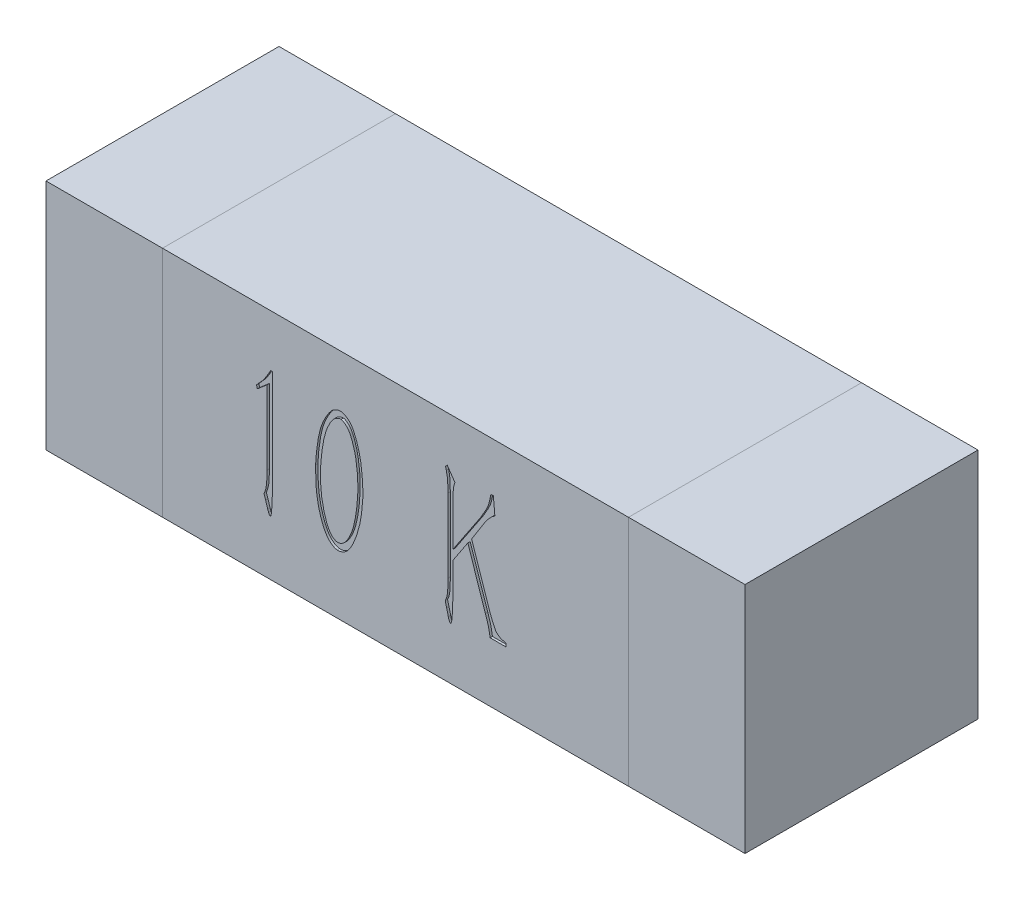
from build123d import *

# Parameters (mm, degrees)
SKETCH_1_W          = 2
SKETCH_1_H          = 1
EXTRUDE_1_DEPTH     = 1
SKETCH_2_W          = 0.5
SKETCH_2_H          = 1
EXTRUDE_2_DEPTH     = 1
EXTRUDE_2_2_DEPTH   = 1
CUT_EXTRUDE_1_DEPTH = 0.01


with BuildPart() as part:
    # 草图1 → 凸台-拉伸1 (new body)
    with BuildSketch(Plane.XY):
        Rectangle(SKETCH_1_W, SKETCH_1_H)
    extrude(amount=EXTRUDE_1_DEPTH)

    # 草图4 → 切除-拉伸1 (cut)
    # profile 1 of 3: a face of its own
    with BuildSketch(Plane.XY.offset(1)):
        with BuildLine():
            Line((-0.536267597, 0.277199445), (-0.527367343, 0.277199445))
            Line((-0.527367343, 0.277199445), (-0.528209259, -0.153981747))
            add(Edge.make_bspline(
                [(-0.528209259, -0.153981747), (-0.528305169, -0.157870332), (-0.528489066, -0.165326261), (-0.528503991, -0.175993761), (-0.528854819, -0.185652194), (-0.528882762, -0.194315386), (-0.529143633, -0.201972021), (-0.529445304, -0.2086237), (-0.529473969, -0.214282893), (-0.530007571, -0.223140259), (-0.53064343, -0.235318477), (-0.532220325, -0.247861835), (-0.533475653, -0.256799503), (-0.534751797, -0.260868085), (-0.536368541, -0.264087281), (-0.537982047, -0.263711863), (-0.538673071, -0.263551082)],
                knots=[0, 0, 0, 0, 1.45038606, 2.780953852, 3.977268029, 5.053718292, 6.010937745, 6.833690271, 7.536464333, 8.120251454, 10.142880859, 12.069479857, 12.873132744, 13.440417135, 13.76034519, 14, 14, 14, 14], degree=3))
            add(Edge.make_bspline(
                [(-0.538673071, -0.263551082), (-0.538832813, -0.263430167), (-0.53951655, -0.262912626), (-0.541147073, -0.26181718), (-0.543084471, -0.258880772), (-0.543932542, -0.25624642), (-0.544446208, -0.254650828)],
                knots=[0, 0, 0, 0, 0.221265066, 0.947068446, 2.150880552, 4, 4, 4, 4], degree=3))
            Line((-0.544446208, -0.254650828), (-0.54841524, -0.244066743))
            Line((-0.54841524, -0.244066743), (-0.557435767, -0.214840236))
            add(Edge.make_bspline(
                [(-0.557435767, -0.214840236), (-0.558521644, -0.212090322), (-0.560413185, -0.207300116), (-0.562321333, -0.200997933), (-0.563768918, -0.196973723), (-0.564153675, -0.193711926), (-0.562300301, -0.190652352), (-0.560935355, -0.185941541), (-0.558835067, -0.1799285), (-0.556851676, -0.172831482), (-0.555099874, -0.165163267), (-0.553521806, -0.156878001), (-0.55262747, -0.147543262), (-0.552188763, -0.138630546), (-0.551852081, -0.130049469), (-0.551790911, -0.121788282), (-0.551622197, -0.112006784), (-0.551648553, -0.104950279), (-0.551662629, -0.101181595)],
                knots=[0, 0, 0, 0, 1.220359697, 2.125803599, 2.712350858, 2.994193817, 3.439826662, 4.12562012, 5.031064022, 6.063176816, 7.167225426, 8.277459231, 9.542238136, 11.034069985, 11.961482632, 13.08703073, 14.444263491, 16, 16, 16, 16], degree=3))
            Line((-0.551662629, -0.101181595), (-0.550940987, 0.217062598))
            Line((-0.550940987, 0.217062598), (-0.593157054, 0.180499395))
            Line((-0.593157054, 0.180499395), (-0.596404443, 0.19433087))
            add(Edge.make_bspline(
                [(-0.596404443, 0.19433087), (-0.592972873, 0.197876729), (-0.586540253, 0.204523589), (-0.577943421, 0.214093872), (-0.570872827, 0.222399361), (-0.563508332, 0.232108868), (-0.555262939, 0.244192288), (-0.549173977, 0.254119734), (-0.546009766, 0.259278665)],
                knots=[0, 0, 0, 0, 1.077185482, 2.019228619, 2.808185376, 3.45765616, 4.678836699, 6, 6, 6, 6], degree=3))
            Line((-0.546009766, 0.259278665), (-0.536267597, 0.277199445))
        make_face()
    # profile 2 of 3: a face of its own
    with BuildSketch(Plane.XY.offset(1)):
        with BuildLine():
            add(Edge.make_bspline(
                [(-0.342867497, 0.023903046), (-0.342475548, 0.03168383), (-0.341672519, 0.047625199), (-0.339489492, 0.072059552), (-0.336269456, 0.097550249), (-0.332535443, 0.123728694), (-0.327368574, 0.149589337), (-0.32075595, 0.174182594), (-0.312314406, 0.196921185), (-0.303891067, 0.21438151), (-0.296770358, 0.227183204), (-0.291589363, 0.235699199), (-0.286660367, 0.243379176), (-0.281804175, 0.250051654), (-0.277037807, 0.255733425), (-0.272642007, 0.260660002), (-0.268205668, 0.264495579), (-0.262641857, 0.268298905), (-0.255869501, 0.271691069), (-0.248021606, 0.274658595), (-0.240470215, 0.276375215), (-0.235550857, 0.276363284), (-0.233177889, 0.276357529)],
                knots=[0, 0, 0, 0, 1.583211401, 3.243703523, 4.983978234, 6.804605119, 8.6166428, 10.340282122, 11.974804003, 13.53820457, 14.274983449, 14.951299633, 15.563740824, 16.129235462, 16.626851747, 17.070813204, 17.469389546, 17.815167281, 18.438300608, 19.002855301, 19.519003895, 20, 20, 20, 20], degree=3))
            add(Edge.make_bspline(
                [(-0.233177889, 0.276357529), (-0.230908792, 0.275960752), (-0.226116106, 0.275122696), (-0.219030562, 0.27200664), (-0.211510276, 0.267862635), (-0.203509087, 0.262491637), (-0.19552066, 0.25527004), (-0.188117295, 0.245705243), (-0.181244193, 0.234023929), (-0.172702923, 0.215536448), (-0.163290732, 0.190477924), (-0.155900326, 0.164166836), (-0.151099749, 0.1421983), (-0.147969005, 0.124670959), (-0.145479562, 0.106084984), (-0.142806295, 0.079956717), (-0.140422232, 0.046475877), (-0.140037994, 0.019497595), (-0.139845502, 0.005982266)],
                knots=[0, 0, 0, 0, 0.36369769, 0.768186139, 1.217229854, 1.724510149, 2.290946358, 2.914777825, 3.632489608, 4.433551378, 6.137860108, 7.866765886, 8.757390638, 9.699141408, 10.686159515, 11.726895222, 13.859299765, 16, 16, 16, 16], degree=3))
            add(Edge.make_bspline(
                [(-0.139845502, 0.005982266), (-0.140581787, -0.004847419), (-0.142095004, -0.02710468), (-0.145694863, -0.06119257), (-0.151632015, -0.096654519), (-0.159103169, -0.126526097), (-0.166329634, -0.150310263), (-0.172457926, -0.167472695), (-0.179314808, -0.183680155), (-0.186633233, -0.198775573), (-0.194246678, -0.212213258), (-0.202127744, -0.223504804), (-0.210455643, -0.232201566), (-0.219011466, -0.238448456), (-0.227365129, -0.242681881), (-0.235347013, -0.245388674), (-0.24294819, -0.246891146), (-0.247886763, -0.246608065), (-0.250256753, -0.246472217)],
                knots=[0, 0, 0, 0, 1.760488992, 3.618172134, 5.557361062, 7.587083219, 8.607294374, 9.588398617, 10.541277716, 11.460251193, 12.307925722, 13.044175775, 13.687957546, 14.251129358, 14.754223989, 15.200440537, 15.616296545, 16, 16, 16, 16], degree=3))
            add(Edge.make_bspline(
                [(-0.250256753, -0.246472217), (-0.252521344, -0.246153894), (-0.257292663, -0.245483211), (-0.264484714, -0.2426609), (-0.271974284, -0.238312478), (-0.279969914, -0.232580364), (-0.288021072, -0.224705299), (-0.295773863, -0.214519445), (-0.303208686, -0.201967456), (-0.310274229, -0.187288782), (-0.316910498, -0.170939239), (-0.322721388, -0.15329783), (-0.328105062, -0.134759644), (-0.332418835, -0.115376996), (-0.335968614, -0.095787708), (-0.338753836, -0.076532326), (-0.340708115, -0.057836114), (-0.341762788, -0.039773641), (-0.34213158, -0.022482982), (-0.342521341, -0.006126426), (-0.34276517, 0.009229013), (-0.342834228, 0.019132125), (-0.342867497, 0.023903046)],
                knots=[0, 0, 0, 0, 0.451175502, 0.950591959, 1.515271951, 2.162531354, 2.891688268, 3.734081857, 4.687580886, 5.773002708, 6.954198864, 8.17563603, 9.445923076, 10.771603705, 12.101713585, 13.383756751, 14.619631726, 15.819374781, 16.961914306, 18.040825747, 19.056148764, 20, 20, 20, 20], degree=3))
        make_face()
        with BuildLine():
            add(Edge.make_bspline(
                [(-0.321699327, 0.022219215), (-0.32178492, 0.018330544), (-0.321966679, 0.010072876), (-0.322139537, -0.003079176), (-0.321817058, -0.017713864), (-0.321266048, -0.039309597), (-0.319243077, -0.06753251), (-0.314072731, -0.10141542), (-0.306688487, -0.134228325), (-0.298551718, -0.159941073), (-0.290976448, -0.178270716), (-0.28516351, -0.189646753), (-0.279048089, -0.198837039), (-0.272640981, -0.205837355), (-0.266160031, -0.210798367), (-0.260103345, -0.214343401), (-0.25436388, -0.216777683), (-0.250517382, -0.217095151), (-0.248693195, -0.21724571)],
                knots=[0, 0, 0, 0, 0.705717407, 1.498604912, 2.386138873, 3.361274458, 5.418191474, 7.514713171, 9.57394393, 11.515405308, 12.398906158, 13.169972934, 13.829695216, 14.395845116, 14.883250105, 15.303691084, 15.669778158, 16, 16, 16, 16], degree=3))
            add(Edge.make_bspline(
                [(-0.248693195, -0.21724571), (-0.247004407, -0.217223989), (-0.243376914, -0.217177332), (-0.237701531, -0.2158125), (-0.231735035, -0.212939484), (-0.225116851, -0.209164089), (-0.218317836, -0.203353655), (-0.211607087, -0.195413035), (-0.205029541, -0.185236213), (-0.198469669, -0.173202445), (-0.192264506, -0.159814176), (-0.186705986, -0.14562978), (-0.181868584, -0.130987522), (-0.176636893, -0.110502014), (-0.171258462, -0.0839331), (-0.166427402, -0.051488117), (-0.163223604, -0.019492727), (-0.161889391, 0.006609391), (-0.161518264, 0.027270715), (-0.161826693, 0.043712144), (-0.162408612, 0.061355531), (-0.163074916, 0.073537027), (-0.163419146, 0.079830314)],
                knots=[0, 0, 0, 0, 0.308126263, 0.661851094, 1.055455993, 1.515432549, 2.051181639, 2.679899785, 3.409545513, 4.262246801, 5.183512362, 6.104777924, 7.045624675, 8.000099589, 9.967578284, 11.997814557, 13.993544283, 15.842664909, 16.77344086, 17.770161498, 18.848005724, 20, 20, 20, 20], degree=3))
            add(Edge.make_bspline(
                [(-0.163419146, 0.079830314), (-0.163999205, 0.085725843), (-0.165125091, 0.09716898), (-0.167104482, 0.113706998), (-0.169560694, 0.129055829), (-0.173021676, 0.147965267), (-0.178608608, 0.170654695), (-0.186304212, 0.192255716), (-0.192941581, 0.208564691), (-0.198646589, 0.218897967), (-0.204449032, 0.227667304), (-0.210897006, 0.234359414), (-0.217173374, 0.239574329), (-0.223080608, 0.243471973), (-0.228597985, 0.246223895), (-0.232313352, 0.246845515), (-0.234019804, 0.247131022)],
                knots=[0, 0, 0, 0, 1.302834758, 2.528783491, 3.662347304, 4.720685654, 6.75648594, 8.792057095, 9.759925264, 10.624039914, 11.384659521, 12.06448684, 12.659424566, 13.175428451, 13.621277708, 14, 14, 14, 14], degree=3))
            add(Edge.make_bspline(
                [(-0.234019804, 0.247131022), (-0.235874806, 0.246996035), (-0.239772824, 0.246712381), (-0.245723503, 0.244888392), (-0.252039413, 0.242036276), (-0.258978313, 0.238080057), (-0.266206661, 0.231730376), (-0.273505362, 0.222435753), (-0.281057617, 0.210107054), (-0.288940151, 0.194930437), (-0.296471704, 0.177049375), (-0.302870736, 0.156568227), (-0.308400342, 0.133833479), (-0.312565377, 0.109486111), (-0.315929892, 0.08511835), (-0.318553271, 0.062213963), (-0.320563029, 0.041486814), (-0.321335053, 0.028396019), (-0.321699327, 0.022219215)],
                knots=[0, 0, 0, 0, 0.347392606, 0.729995465, 1.156884588, 1.644891073, 2.219813456, 2.945627096, 3.849684979, 4.924243867, 6.145708801, 7.477723151, 8.938118981, 10.524254447, 12.100980159, 13.544449593, 14.841364989, 16, 16, 16, 16], degree=3))
        make_face(mode=Mode.SUBTRACT)
    # profile 3 of 3: a face of its own
    with BuildSketch(Plane.XY.offset(1)):
        with BuildLine():
            Line((0.246233054, 0.003576792), (0.365544559, 0.182183227))
            add(Edge.make_bspline(
                [(0.365544559, 0.182183227), (0.366266798, 0.183345469), (0.368128547, 0.186341427), (0.37150394, 0.191822862), (0.37580006, 0.19950751), (0.381006858, 0.208627921), (0.386418379, 0.218185097), (0.391104085, 0.227116137), (0.3947226, 0.234892567), (0.398632659, 0.243857568), (0.402316668, 0.255656158), (0.40429023, 0.265430496), (0.405355151, 0.270704666)],
                knots=[0, 0, 0, 0, 0.420080696, 1.08285973, 1.975895696, 3.122344224, 4.307000813, 5.347403028, 6.217326357, 6.939704131, 8.348684182, 10, 10, 10, 10], degree=3))
            Line((0.405355151, 0.270704666), (0.409444457, 0.290189004))
            Line((0.409444457, 0.290189004), (0.420028542, 0.290189004))
            Line((0.420028542, 0.290189004), (0.426523321, 0.217904514))
            add(Edge.make_bspline(
                [(0.426523321, 0.217904514), (0.424455481, 0.216574072), (0.420511713, 0.214036662), (0.415858677, 0.210388369), (0.412023841, 0.207153643), (0.408848211, 0.203664946), (0.40485442, 0.199518495), (0.398972748, 0.192960091), (0.391744113, 0.184595283), (0.386700406, 0.17741265), (0.384307255, 0.174004616)],
                knots=[0, 0, 0, 0, 0.961837198, 1.834408076, 2.312695353, 2.923075551, 3.677929009, 4.566716946, 6.370966884, 8, 8, 8, 8], degree=3))
            Line((0.384307255, 0.174004616), (0.326575882, 0.082356061))
            Line((0.326575882, 0.082356061), (0.406197067, -0.153139831))
            add(Edge.make_bspline(
                [(0.406197067, -0.153139831), (0.406701498, -0.15470939), (0.407878119, -0.158370495), (0.410344911, -0.164431835), (0.413487127, -0.171922139), (0.417124672, -0.180306351), (0.420825949, -0.188698647), (0.42452017, -0.195937169), (0.42733027, -0.201930033), (0.430663706, -0.207994025), (0.435991064, -0.214418578), (0.444247228, -0.220337692), (0.453320217, -0.225312657), (0.459875485, -0.227023258), (0.46296625, -0.227829795)],
                knots=[0, 0, 0, 0, 0.601283206, 1.402534455, 2.385877248, 3.565090634, 4.736842296, 5.731110854, 6.529151735, 7.151416212, 8.252576758, 9.536782906, 10.838609505, 12, 12, 12, 12], degree=3))
            Line((0.46296625, -0.227829795), (0.475234167, -0.231077184))
            Line((0.475234167, -0.231077184), (0.475234167, -0.244908659))
            Line((0.475234167, -0.244908659), (0.406197067, -0.244908659))
            add(Edge.make_bspline(
                [(0.406197067, -0.244908659), (0.405625685, -0.241783263), (0.404440291, -0.2352993), (0.402831541, -0.225377353), (0.401147906, -0.215354056), (0.399209085, -0.206694722), (0.396949087, -0.19848357), (0.394105894, -0.189617364), (0.390419187, -0.177924375), (0.387492301, -0.169250734), (0.385870813, -0.164445558)],
                knots=[0, 0, 0, 0, 0.916910572, 1.902227753, 2.90090532, 3.849675465, 4.461593695, 5.358203872, 6.536451397, 8, 8, 8, 8], degree=3))
            Line((0.385870813, -0.164445558), (0.310338933, 0.059624333))
            Line((0.310338933, 0.059624333), (0.246233054, -0.037075716))
            Line((0.246233054, -0.037075716), (0.246233054, -0.177435117))
            Line((0.246233054, -0.177435117), (0.243827581, -0.235888132))
            add(Edge.make_bspline(
                [(0.243827581, -0.235888132), (0.243691298, -0.239297499), (0.243439305, -0.245601607), (0.242748324, -0.254308041), (0.24177885, -0.261502335), (0.240795526, -0.267184416), (0.23951946, -0.271435355), (0.238682114, -0.274029488), (0.237676969, -0.276038217), (0.236786669, -0.275783387), (0.236490885, -0.275698725)],
                knots=[0, 0, 0, 0, 1.962828299, 3.629378072, 5.025620302, 6.129446706, 6.969082562, 7.509057143, 7.836894713, 8, 8, 8, 8], degree=3))
            add(Edge.make_bspline(
                [(0.236490885, -0.275698725), (0.23612677, -0.275589518), (0.235229447, -0.275320391), (0.2334179, -0.274301853), (0.231530705, -0.271046539), (0.229414627, -0.266367546), (0.227443611, -0.261138607), (0.226947987, -0.257626474), (0.226748716, -0.256214386)],
                knots=[0, 0, 0, 0, 0.30186791, 0.743920916, 1.609509567, 3.189637424, 4.870065584, 6, 6, 6, 6], degree=3))
            Line((0.226748716, -0.256214386), (0.219412021, -0.226987879))
            add(Edge.make_bspline(
                [(0.219412021, -0.226987879), (0.218544092, -0.223989858), (0.217032905, -0.218769878), (0.215409512, -0.212019315), (0.214303845, -0.207659041), (0.213503458, -0.204397854), (0.214772602, -0.200750858), (0.216550758, -0.19592438), (0.219049108, -0.190496899), (0.220784465, -0.184553136), (0.222191771, -0.17764317), (0.223213082, -0.16903185), (0.224147838, -0.159367142), (0.224655492, -0.150818404), (0.225007705, -0.143079797), (0.225055978, -0.135258794), (0.225229089, -0.125397333), (0.22520069, -0.118140324), (0.225185158, -0.114171154)],
                knots=[0, 0, 0, 0, 1.303234359, 2.269115785, 2.890039559, 3.195386403, 3.64187597, 4.446796483, 5.369688572, 6.121366675, 7.027109972, 8.309771923, 9.738354317, 11.079598601, 11.883474893, 12.971242357, 14.343442508, 16, 16, 16, 16], degree=3))
            Line((0.225185158, -0.114171154), (0.225185158, 0.202509481))
            add(Edge.make_bspline(
                [(0.225185158, 0.202509481), (0.225203402, 0.204714801), (0.225242553, 0.209447488), (0.224901521, 0.217021482), (0.224722396, 0.225603909), (0.224351387, 0.234824747), (0.223949441, 0.243892255), (0.223276695, 0.251982022), (0.222810151, 0.258745365), (0.221596006, 0.265952656), (0.220072269, 0.274149464), (0.218594549, 0.280491959), (0.217848463, 0.283694225)],
                knots=[0, 0, 0, 0, 0.809324544, 1.736836047, 2.782014883, 3.960041647, 5.124015164, 6.112661131, 6.939978743, 7.610116978, 8.79337068, 10, 10, 10, 10], degree=3))
            Line((0.217848463, 0.283694225), (0.214601073, 0.296683784))
            Line((0.214601073, 0.296683784), (0.221937768, 0.304742121))
            Line((0.221937768, 0.304742121), (0.255133308, 0.256873191))
            add(Edge.make_bspline(
                [(0.255133308, 0.256873191), (0.254172083, 0.254240754), (0.252470246, 0.249580051), (0.250850943, 0.243767069), (0.250003666, 0.239159494), (0.249277698, 0.234915616), (0.248605896, 0.229569916), (0.247349628, 0.220707032), (0.246382571, 0.207740787), (0.246285248, 0.196898283), (0.246233054, 0.191083481)],
                knots=[0, 0, 0, 0, 1.007435709, 1.783654327, 2.165285696, 2.691347983, 3.331434253, 4.102011478, 5.909520124, 8, 8, 8, 8], degree=3))
            Line((0.246233054, 0.191083481), (0.246233054, 0.003576792))
        make_face()
    extrude(amount=-CUT_EXTRUDE_1_DEPTH, mode=Mode.SUBTRACT)


with BuildPart() as body_2:
    # 草图2 → 凸台-拉伸2 (new body)
    with BuildSketch(Plane(origin=(0, 0, 0), x_dir=(-1, 0, 0), z_dir=(0, 0, -1))):
        with Locations((1.25, 0)):
            Rectangle(SKETCH_2_W, SKETCH_2_H)
    extrude(amount=-EXTRUDE_2_DEPTH)


with BuildPart() as body_3:
    # 草图2 → Extrude 2 2 (new body)
    with BuildSketch(Plane(origin=(0, 0, 0), x_dir=(-1, 0, 0), z_dir=(0, 0, -1))):
        with Locations((-1.25, 0)):
            Rectangle(SKETCH_2_W, SKETCH_2_H)
    extrude(amount=-EXTRUDE_2_2_DEPTH)


solid = Compound([part.part, body_2.part, body_3.part])
